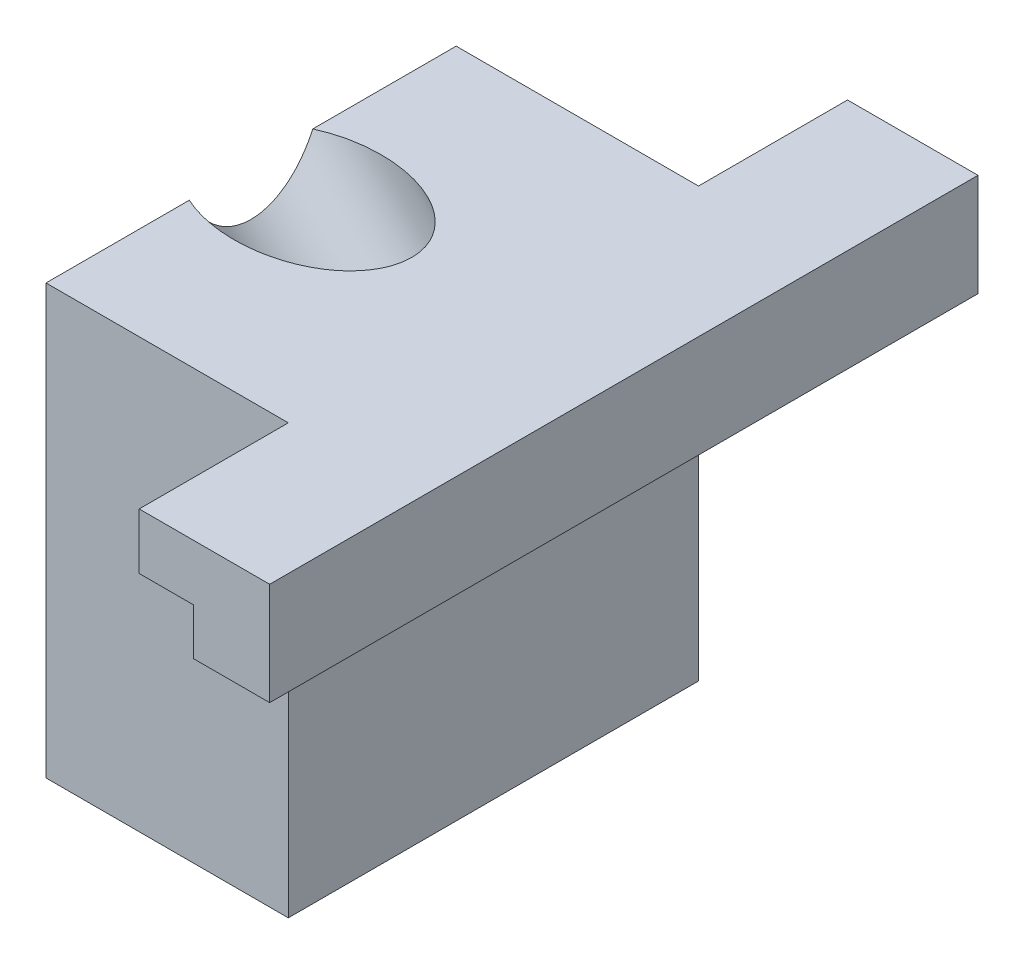
from build123d import *

# Parameters (mm, degrees)
SKETCH_1_W               = 22
SKETCH_1_H               = 20
EXTRUDE_1_DEPTH          = 13
SKETCH_2_W               = 15.9
SKETCH_2_H               = 22.004551976
EXTRUDE_2_DEPTH          = 3
SKETCH_3_W               = 22
SKETCH_3_H               = 5.5
EXTRUDE_3_DEPTH          = 4.1
EXTRUDE_4_DEPTH          = 8
EXTRUDE_5_DEPTH          = 8
SKETCH_7_R               = 1.5
CUT_EXTRUDE_1_DEPTH      = 5
CUT_EXTRUDE_2_DEPTH      = 35.799425283
CUT_EXTRUDE_2_DEPTH_BACK = 9
SKETCH_9_R               = 3.95


with BuildPart() as part:
    # 草图1 → 凸台-拉伸1 (new body)
    with BuildSketch(Plane(origin=(0, 0, 0), x_dir=(0, 0, -1), z_dir=(1, 0, 0))):
        Rectangle(SKETCH_1_W, SKETCH_1_H)
    extrude(amount=EXTRUDE_1_DEPTH)

    # 草图2 → 凸台-拉伸2 (add)
    with BuildSketch(Plane(origin=(0, 10, 0), x_dir=(1, 0, 0), z_dir=(0, 1, 0))):
        with Locations((7.95, 0.002275988)):
            Rectangle(SKETCH_2_W, SKETCH_2_H)
    extrude(amount=EXTRUDE_2_DEPTH)

    # 草图3 → 凸台-拉伸3 (add)
    with BuildSketch(Plane(origin=(15.9, 0, 0), x_dir=(0, 0, -1), z_dir=(1, 0, 0))):
        with Locations((0, 10.25)):
            Rectangle(SKETCH_3_W, SKETCH_3_H)
    extrude(amount=EXTRUDE_3_DEPTH)

    # 草图5 → 凸台-拉伸4 (add)
    with BuildSketch(Plane.XY.offset(11)):
        Polygon((13, 13), (13, 10), (15.9, 10), (15.9, 7.5), (20, 7.5), (20, 13), align=None)
    extrude(amount=EXTRUDE_4_DEPTH)

    # 草图6 → 凸台-拉伸5 (add)
    with BuildSketch(Plane(origin=(0, 0, -11), x_dir=(-1, 0, 0), z_dir=(0, 0, -1))):
        Polygon((-13, 13), (-13, 10), (-15.9, 10), (-15.9, 7.5), (-20, 7.5), (-20, 13), align=None)
    extrude(amount=EXTRUDE_5_DEPTH)

    # 草图7 → 切除-拉伸1 (cut)
    with BuildSketch(Plane(origin=(13, 0, 0), x_dir=(0, 0, -1), z_dir=(1, 0, 0))):
        with Locations((0, 2.1)):
            Circle(SKETCH_7_R)
    extrude(amount=-CUT_EXTRUDE_1_DEPTH, mode=Mode.SUBTRACT)

    # 草图9 → 切除-拉伸2 (cut, two sides: drawn at the far end of the back side and taken through both)
    with BuildSketch(Plane(origin=(-5, 5, 0), x_dir=(0, 0, -1), z_dir=(-0.7071067811865464, 0.7071067811865488, 0)).offset(-CUT_EXTRUDE_2_DEPTH_BACK)):
        with Locations(Location((0, -11.341614651, 0), (0, 0, 147.03627328))):
            Circle(SKETCH_9_R)
    extrude(amount=CUT_EXTRUDE_2_DEPTH + CUT_EXTRUDE_2_DEPTH_BACK, mode=Mode.SUBTRACT)


solid = part.part
